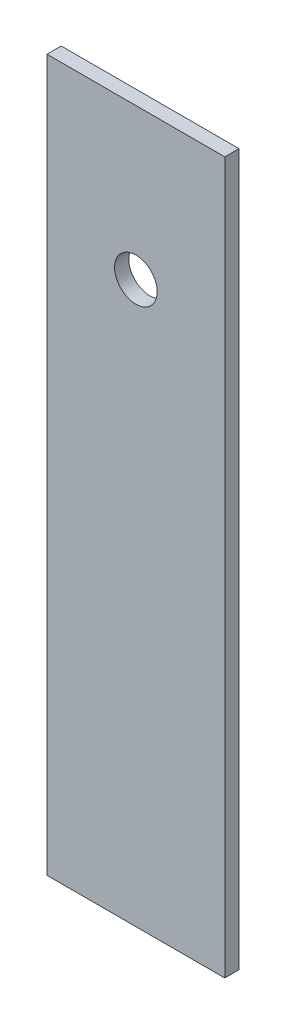
from build123d import *

# Parameters (mm, degrees)
SKETCH_1_W      = 25
SKETCH_1_H      = 100
SKETCH_1_R      = 3
EXTRUDE_1_DEPTH = 2


with BuildPart() as part:
    # ｽｹｯﾁ1 → ﾎﾞｽ - 押し出し1 (new body)
    with BuildSketch(Plane.XY):
        Rectangle(SKETCH_1_W, SKETCH_1_H)
        with Locations((0, 28.8)):
            Circle(SKETCH_1_R, mode=Mode.SUBTRACT)
    extrude(amount=EXTRUDE_1_DEPTH)


solid = part.part
